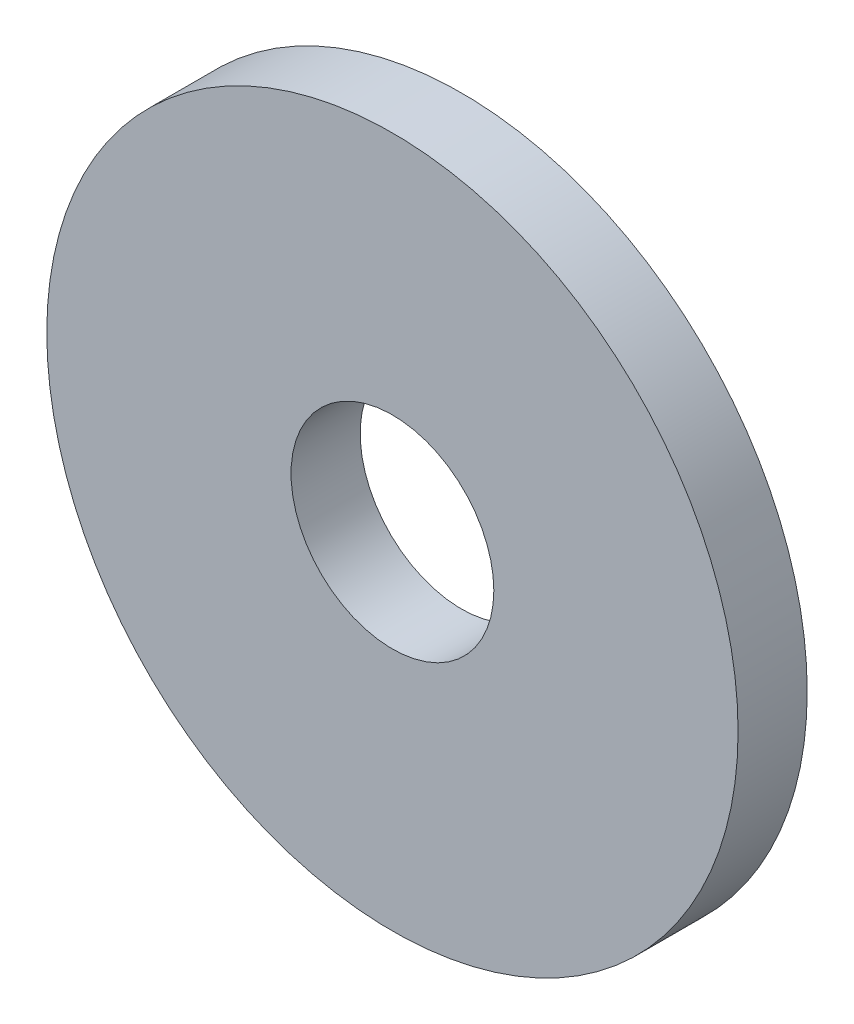
from build123d import *

# Parameters (mm, degrees)
SKETCH_1_R      = 15
SKETCH_1_R_2    = 4.4
EXTRUDE_1_DEPTH = 3


with BuildPart() as part:
    # Эскиз1 → Бобышка-Вытянуть1 (new body)
    with BuildSketch(Plane.XY):
        Circle(SKETCH_1_R)
        Circle(SKETCH_1_R_2, mode=Mode.SUBTRACT)
    extrude(amount=EXTRUDE_1_DEPTH)


solid = part.part
